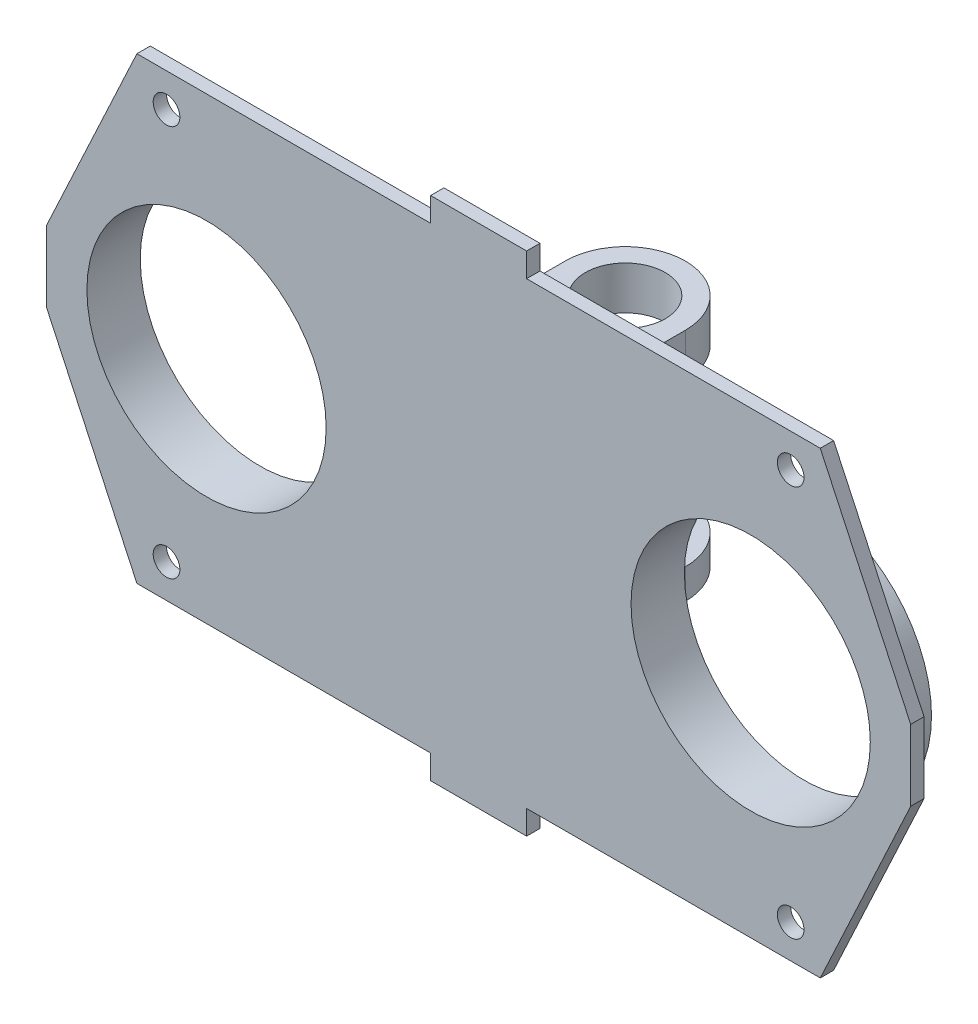
from build123d import *

# Parameters (mm, degrees)
SKETCH1_R           = 5
BOSS_EXTRUDE3_DEPTH = 5
BOSS_EXTRUDE4_DEPTH = 10
SKETCH1_6_R         = 47.8
SKETCH1_6_R_2       = 44.85
BOSS_EXTRUDE5_DEPTH = 20
SKETCH2_R           = 15
BOSS_EXTRUDE6_DEPTH = 88
SKETCH3_W           = 90.131554877
SKETCH3_H           = 60.595357862
CUT_EXTRUDE1_DEPTH  = 57


with BuildPart() as part:
    # Sketch1 → Boss-Extrude3 (new body)
    with BuildSketch(Plane.XY):
        Polygon((-18, 86), (-128.1, 86), (-162, 13.3), (-162, -13.3), (-128.1, -86), (-18, -86), (-18, -95), (18, -95), (18, -86), (128.1, -86), (162, -13.3), (162, 13.3), (128.1, 86), (18, 86), (18, 95), (-18, 95), align=None)
        with Locations((-117, -73.410936815)):
            Circle(SKETCH1_R, mode=Mode.SUBTRACT)
        with Locations((117, -73.410936815)):
            Circle(SKETCH1_R, mode=Mode.SUBTRACT)
        with BuildLine():
            ThreePointArc((-83.3227411, -44), (-149.8, 0), (-83.3227411, 44))
            Line((-83.3227411, 44), (83.3227411, 44))
            ThreePointArc((83.3227411, 44), (128.382447049, 39.85983552), (149.8, 0))
            ThreePointArc((149.8, 0), (128.382447049, -39.85983552), (83.3227411, -44))
            Line((83.3227411, -44), (-83.3227411, -44))
        make_face(mode=Mode.SUBTRACT)
        with Locations((-117, 73.410936815)):
            Circle(SKETCH1_R, mode=Mode.SUBTRACT)
        with Locations((117, 73.410936815)):
            Circle(SKETCH1_R, mode=Mode.SUBTRACT)
    extrude(amount=-BOSS_EXTRUDE3_DEPTH)

    # Sketch1<5> → Boss-Extrude4 (add)
    with BuildSketch(Plane.XY):
        with BuildLine():
            Line((83.3227411, 44), (-83.3227411, 44))
            ThreePointArc((-83.3227411, 44), (-62.14016448, 26.382447049), (-54.2, 0))
            ThreePointArc((-54.2, 0), (-62.14016448, -26.382447049), (-83.3227411, -44))
            Line((-83.3227411, -44), (83.3227411, -44))
            ThreePointArc((83.3227411, -44), (54.2, 0), (83.3227411, 44))
        make_face()
    extrude(amount=-BOSS_EXTRUDE4_DEPTH)

    # Sketch1<6> → Boss-Extrude5 (add)
    # profile 1 of 2: a face of its own
    with BuildSketch(Plane.XY):
        with Locations((-102, 0)):
            Circle(SKETCH1_6_R)
        with Locations((-102, 0)):
            Circle(SKETCH1_6_R_2, mode=Mode.SUBTRACT)
    # profile 2 of 2: a face of its own
    with BuildSketch(Plane.XY):
        with Locations((102, 0)):
            Circle(SKETCH1_6_R)
        with Locations((102, 0)):
            Circle(SKETCH1_6_R_2, mode=Mode.SUBTRACT)
    extrude(amount=-BOSS_EXTRUDE5_DEPTH)

    # Sketch2 → Boss-Extrude6 (add)
    with BuildSketch(Plane.XZ.offset(44)):
        with BuildLine():
            Line((22.5, -55), (22.5, -10))
            Line((22.5, -10), (-22.5, -10))
            Line((-22.5, -10), (-22.5, -55))
            ThreePointArc((-22.5, -55), (0, -77.5), (22.5, -55))
        make_face()
        with Locations((0, -55)):
            Circle(SKETCH2_R, mode=Mode.SUBTRACT)
    extrude(amount=-BOSS_EXTRUDE6_DEPTH)

    # Sketch3 → Cut-Extrude1 (cut)
    with BuildSketch(Plane.ZY.offset(22.5)):
        with Locations((-75.065777439, -2.502321069)):
            Rectangle(SKETCH3_W, SKETCH3_H)
    extrude(amount=-CUT_EXTRUDE1_DEPTH, mode=Mode.SUBTRACT)


solid = part.part
